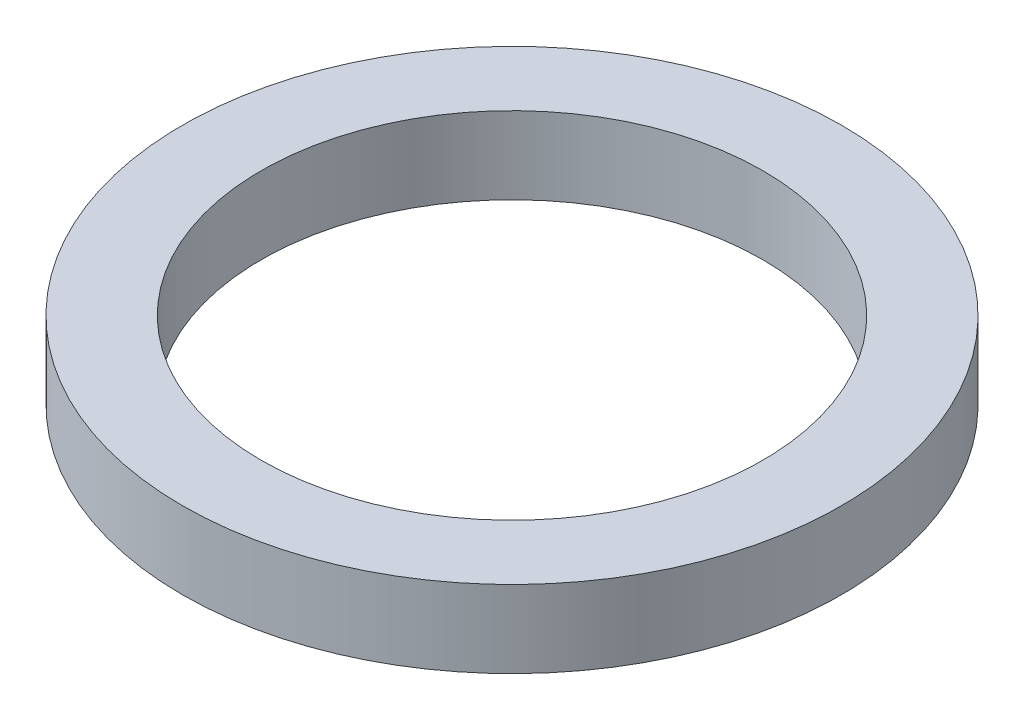
from build123d import *

# Parameters (mm, degrees)
SKETCH1_R           = 27.1145
SKETCH1_R_2         = 20.6375
BOSS_EXTRUDE1_DEPTH = 6.35


with BuildPart() as part:
    # Sketch1 → Boss-Extrude1 (new body)
    with BuildSketch(Plane(origin=(0, 0, 0), x_dir=(1, 0, 0), z_dir=(0, 1, 0))):
        with Locations(Location((0, 0, 0), (0, 0, 270))):
            Circle(SKETCH1_R)
        with Locations(Location((0, 0, 0), (0, 0, 270))):
            Circle(SKETCH1_R_2, mode=Mode.SUBTRACT)
    extrude(amount=BOSS_EXTRUDE1_DEPTH)


solid = part.part
